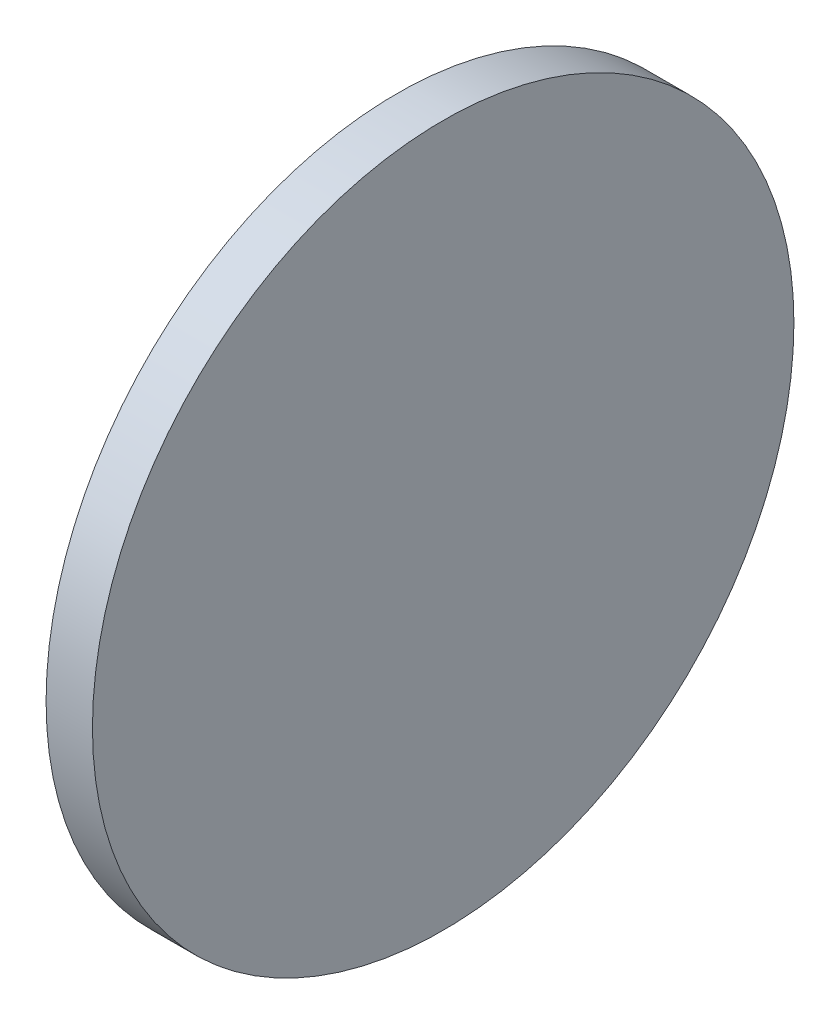
from build123d import *

# Parameters (mm, degrees)
SKETCH1_W = 1.5748
SKETCH1_H = 11.9126


with BuildPart() as part:
    # Sketch1 → Revolve1 (revolve)
    with BuildSketch(Plane(origin=(0, 0, 0), x_dir=(1, 0, 0), z_dir=(0, 1, 0)), mode=Mode.PRIVATE) as revolve1_sk:
        with Locations((0, 5.9563)):
            Rectangle(SKETCH1_W, SKETCH1_H)
    revolve(revolve1_sk.sketch.rotate(Axis((-0.7874, 0, 0), (1, 0, 0)), 180), axis=Axis((-0.7874, 0, 0), (1, 0, 0)))


solid = part.part
